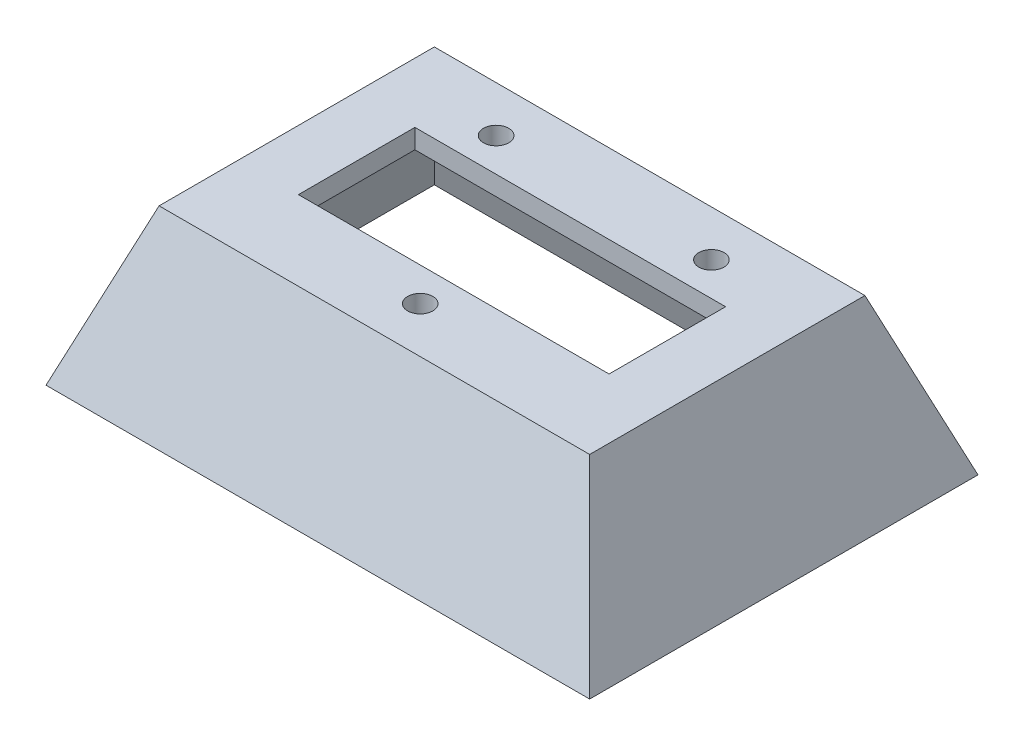
from build123d import *

# Parameters (mm, degrees)
SKETCH1_W           = 140
SKETCH1_H           = 100
BOSS_EXTRUDE2_DEPTH = 40
BOSS_EXTRUDE2_TAPER = 20
SHELL1_T            = -5
SKETCH3_R           = 3.25
SKETCH3_W           = 80
SKETCH3_H           = 30
CUT_EXTRUDE1_DEPTH  = 95.868329974


with BuildPart() as part:
    # Sketch1 → Boss-Extrude2 (new body)
    with BuildSketch(Plane(origin=(0, 0, 0), x_dir=(1, 0, 0), z_dir=(0, 1, 0))):
        Rectangle(SKETCH1_W, SKETCH1_H)
    extrude(amount=BOSS_EXTRUDE2_DEPTH, taper=BOSS_EXTRUDE2_TAPER)

    # Shell1
    shell1_openings = [part.faces().sort_by_distance(p)[0] for p in [
        (0, 0, 0),
    ]]
    offset(amount=SHELL1_T, openings=shell1_openings, kind=Kind.INTERSECTION)

    # Sketch3 → Cut-Extrude1 (cut, through all)
    with BuildSketch(Plane(origin=(0, 40, 0), x_dir=(1, 0, 0), z_dir=(0, 1, 0))):
        with Locations(Location((0, -23.631190629, 0), (0, 0, 270))):
            Circle(SKETCH3_R)
        with Locations(Location((-27.720595315, 23.631190629, 0), (0, 0, 270))):
            Circle(SKETCH3_R)
        with Locations(Location((27.720595315, 23.631190629, 0), (0, 0, 270))):
            Circle(SKETCH3_R)
        Rectangle(SKETCH3_W, SKETCH3_H)
    extrude(amount=-CUT_EXTRUDE1_DEPTH, mode=Mode.SUBTRACT)


solid = part.part
